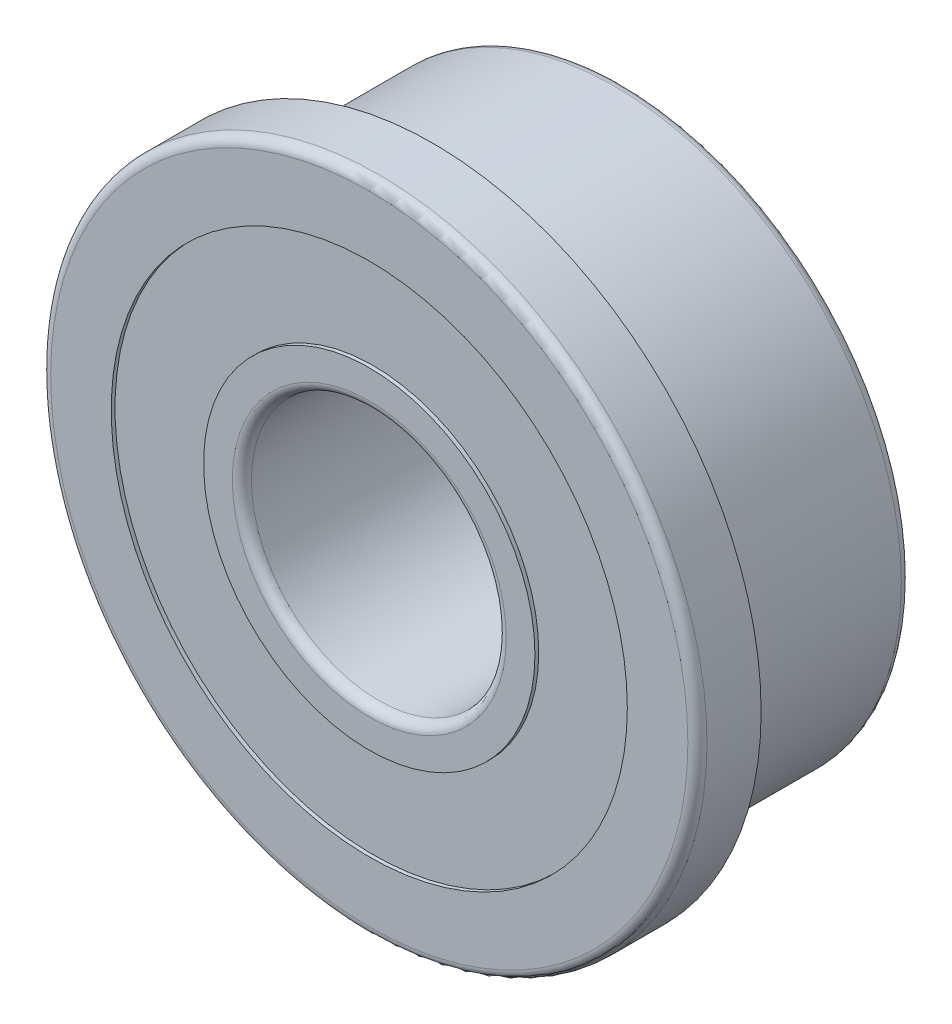
from build123d import *

# Parameters (mm, degrees)
SKETCH1_R           = 4.5
BOSS_EXTRUDE1_DEPTH = 3
SKETCH2_R           = 5.15
BOSS_EXTRUDE2_DEPTH = 1
SKETCH3_R           = 2
CUT_EXTRUDE1_DEPTH  = 9.309332103
SKETCH4_R           = 4.05
SKETCH4_R_2         = 2.6
CUT_EXTRUDE2_DEPTH  = 0.06
CUT_EXTRUDE3_START  = -0.06
SKETCH5_R           = 4.05
SKETCH5_R_2         = 2.6
CUT_EXTRUDE3_DEPTH  = 0.06
FILLET1_R           = 0.15


with BuildPart() as part:
    # Sketch1 → Boss-Extrude1 (new body)
    with BuildSketch(Plane.XY):
        Circle(SKETCH1_R)
    extrude(amount=BOSS_EXTRUDE1_DEPTH)

    # Sketch2 → Boss-Extrude2 (add)
    with BuildSketch(Plane.XY.offset(3)):
        Circle(SKETCH2_R)
    extrude(amount=BOSS_EXTRUDE2_DEPTH)

    # Sketch3 → Cut-Extrude1 (cut, through all)
    with BuildSketch(Plane.XY.offset(4)):
        Circle(SKETCH3_R)
    extrude(amount=-CUT_EXTRUDE1_DEPTH, mode=Mode.SUBTRACT)

    # Sketch4 → Cut-Extrude2 (cut)
    with BuildSketch(Plane.XY.offset(4)):
        Circle(SKETCH4_R)
        Circle(SKETCH4_R_2, mode=Mode.SUBTRACT)
    extrude(amount=-CUT_EXTRUDE2_DEPTH, mode=Mode.SUBTRACT)

    # Sketch5 → Cut-Extrude3 (cut)
    with BuildSketch(Plane(origin=(0, 0, 0), x_dir=(-1, 0, 0), z_dir=(0, 0, -1)).offset(CUT_EXTRUDE3_START)):
        with Locations(Location((0, 0, 0), (0, 0, 180))):
            Circle(SKETCH5_R)
        with Locations(Location((0, 0, 0), (0, 0, 180))):
            Circle(SKETCH5_R_2, mode=Mode.SUBTRACT)
    extrude(amount=CUT_EXTRUDE3_DEPTH, mode=Mode.SUBTRACT)

    # Fillet1
    fillet1_edges = [part.edges().sort_by_distance(p)[0] for p in [
        (-2, 0, 0),
        (-2, 0, 4),
        (-4.5, 0, 0),
        (-5.15, 0, 4),
    ]]
    fillet(fillet1_edges, radius=FILLET1_R)


solid = part.part
